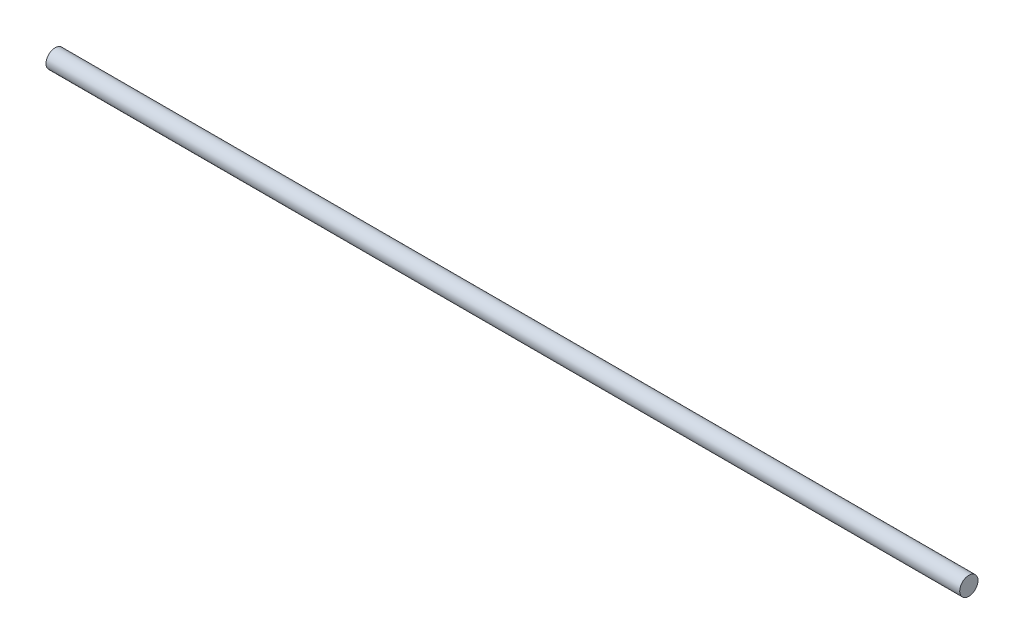
from build123d import *

# Parameters (mm, degrees)
SKETCH1_R           = 1
BOSS_EXTRUDE1_DEPTH = 50


with BuildPart() as part:
    # Sketch1 → Boss-Extrude1 (new, symmetric)
    with BuildSketch(Plane.YZ):
        with Locations(Location((0, 0, 0), (0, 0, 270))):
            Circle(SKETCH1_R)
    extrude(amount=BOSS_EXTRUDE1_DEPTH, both=True)


solid = part.part
